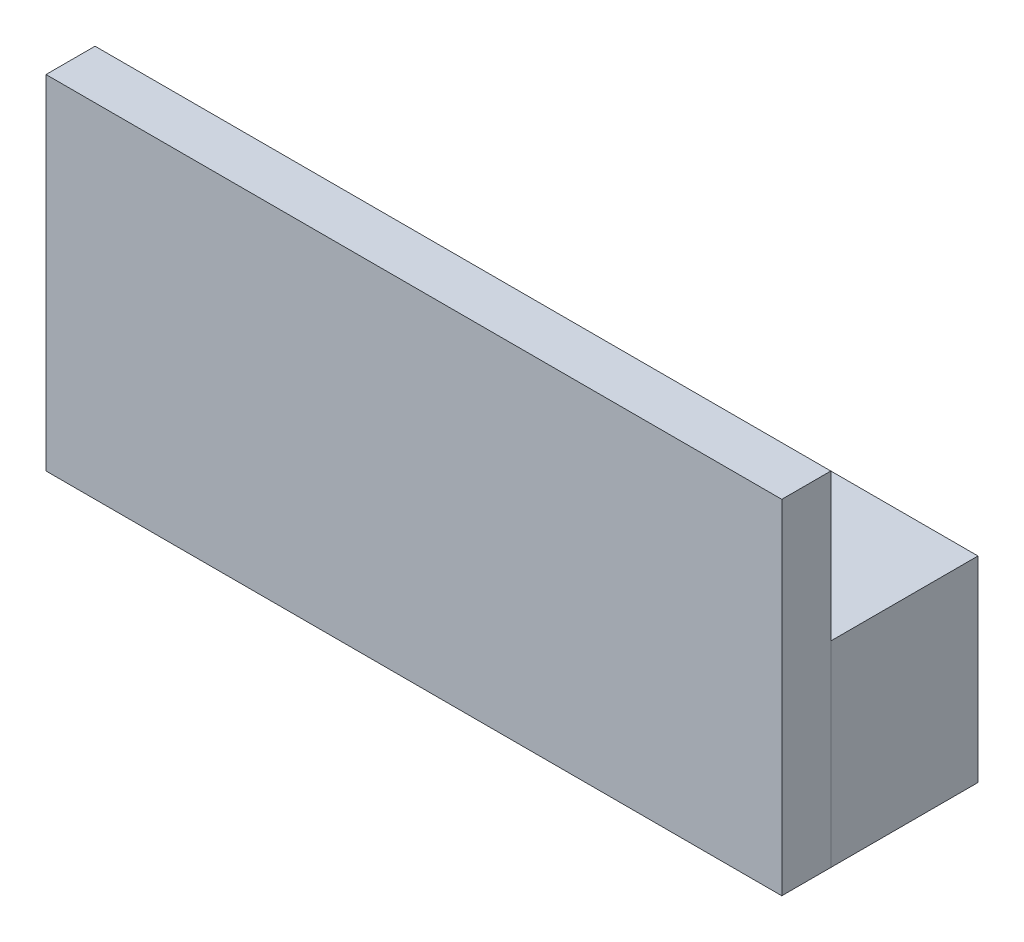
from build123d import *

# Parameters (mm, degrees)
SKETCH_1_W          = 20
SKETCH_1_H          = 20
EXTRUDE_1_DEPTH     = 10
SKETCH_2_R          = 4
CUT_EXTRUDE_1_DEPTH = 15
EXTRUDE_START       = 10
SKETCH_3_W          = 75
SKETCH_3_H          = 35
EXTRUDE_2_DEPTH     = 5
SKETCH_4_W          = 20
SKETCH_4_H          = 20
EXTRUDE_3_DEPTH     = 5


with BuildPart() as part:
    # 草图1 → 凸台-拉伸1 (new body)
    with BuildSketch(Plane.XY):
        Rectangle(SKETCH_1_W, SKETCH_1_H)
    extrude(amount=EXTRUDE_1_DEPTH)

    # 草图2 → 切除-拉伸1 (cut)
    with BuildSketch(Plane.ZY.offset(10)):
        with Locations((5, 0)):
            Circle(SKETCH_2_R)
    extrude(amount=-CUT_EXTRUDE_1_DEPTH, mode=Mode.SUBTRACT)

    # 草图4 → 凸台-拉伸3 (add)
    with BuildSketch(Plane.XY.offset(10)):
        Rectangle(SKETCH_4_W, SKETCH_4_H)
    extrude(amount=EXTRUDE_3_DEPTH)


with BuildPart() as body_2:
    # 草图3 → 凸台-拉伸2 (new body)
    with BuildSketch(Plane.XY.offset(10).offset(EXTRUDE_START)):
        with Locations((-27.5, 7.5)):
            Rectangle(SKETCH_3_W, SKETCH_3_H)
    extrude(amount=-EXTRUDE_2_DEPTH)


solid = Compound([part.part, body_2.part])
